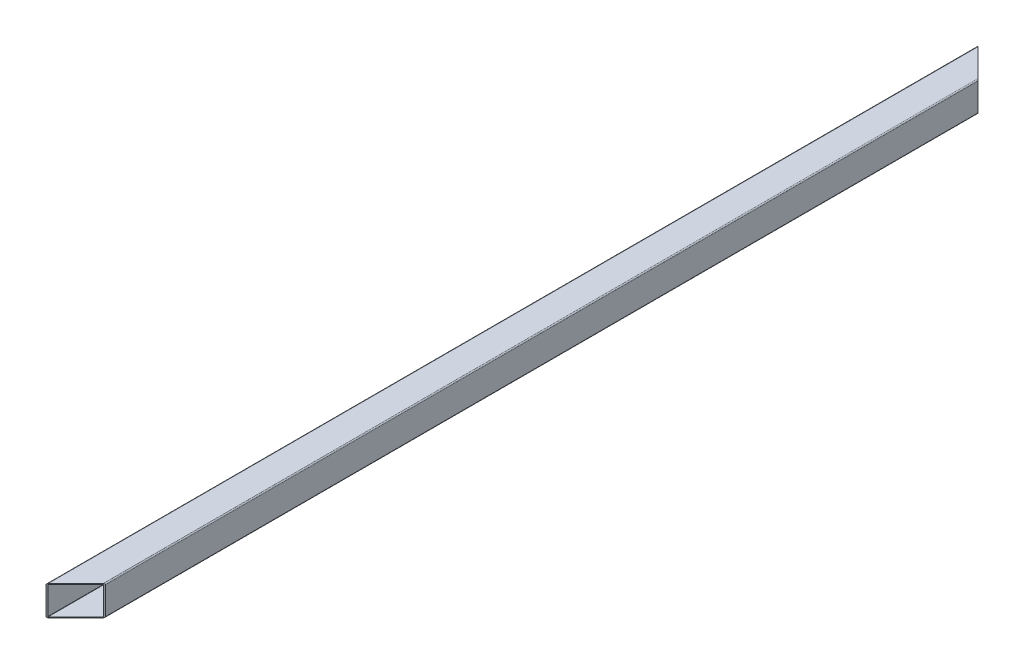
from build123d import *

# Parameters (mm, degrees)
STRUCTURAL_MEMBER1_DEPTH = 1255
CUT_EXTRUDE1_DEPTH       = 50


with BuildPart() as part:
    # Sketch12 → Structural Member1 (new body)
    with BuildSketch(Plane(origin=(0, 0, 0), x_dir=(-1, 0, 0), z_dir=(0, 0, -1))):
        with BuildLine():
            Line((-18.5, -20), (18.5, -20))
            ThreePointArc((18.5, -20), (19.560660172, -19.560660172), (20, -18.5))
            Line((20, -18.5), (20, 18.5))
            ThreePointArc((20, 18.5), (19.560660172, 19.560660172), (18.5, 20))
            Line((18.5, 20), (-18.5, 20))
            ThreePointArc((-18.5, 20), (-19.560660172, 19.560660172), (-20, 18.5))
            Line((-20, 18.5), (-20, -18.5))
            ThreePointArc((-20, -18.5), (-19.560660172, -19.560660172), (-18.5, -20))
        make_face()
        with BuildLine():
            Line((-18.5, -18.8), (18.5, -18.8))
            ThreePointArc((18.5, -18.8), (18.712132034, -18.712132034), (18.8, -18.5))
            Line((18.8, -18.5), (18.8, 18.5))
            ThreePointArc((18.8, 18.5), (18.712132034, 18.712132034), (18.5, 18.8))
            Line((18.5, 18.8), (-18.5, 18.8))
            ThreePointArc((-18.5, 18.8), (-18.712132034, 18.712132034), (-18.8, 18.5))
            Line((-18.8, 18.5), (-18.8, -18.5))
            ThreePointArc((-18.8, -18.5), (-18.712132034, -18.712132034), (-18.5, -18.8))
        make_face(mode=Mode.SUBTRACT)
    extrude(amount=STRUCTURAL_MEMBER1_DEPTH)

    # Sketch13 → Cut-Extrude1 (cut)
    with BuildSketch(Plane(origin=(0, 20, 0), x_dir=(1, 0, 0), z_dir=(0, 1, 0))):
        Polygon((-20, 1255), (31.574006929, 1203.425993071), (31.574006929, 1272.147428422), align=None)
        Polygon((31.574006929, -17.147428422), (-20, 0), (31.574006929, 51.574006929), align=None)
    extrude(amount=-CUT_EXTRUDE1_DEPTH, mode=Mode.SUBTRACT)


solid = part.part
